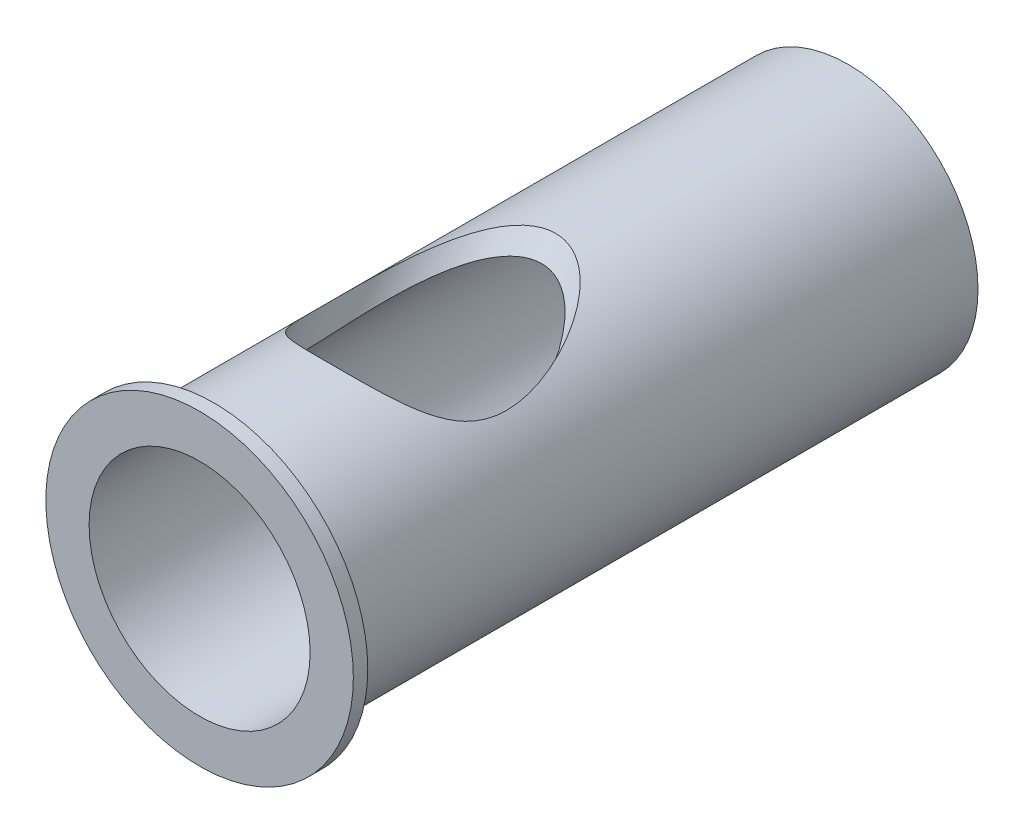
from build123d import *
from build123d.topology import SkipClean

# Parameters (mm, degrees)
ESQUISSE1_R                  = 8
ESQUISSE1_R_2                = 5.75
BASE_EXTRUSION_DEPTH         = 0.75
BOSS_EXTRU_1_START           = 33
ESQUISSE2_R                  = 6.75
ESQUISSE2_R_2                = 5.75
BOSS_EXTRU_1_DEPTH           = 33
ENL_V_MAT_EXTRU_1_REACH      = 34.989
ENL_V_MAT_EXTRU_1_END_RADIUS = 5.75
ESQUISSE3_R                  = 4.75


with BuildPart() as part:
    # Esquisse1 → Base-Extrusion (new body)
    with BuildSketch(Plane.XY):
        Circle(ESQUISSE1_R)
        Circle(ESQUISSE1_R_2, mode=Mode.SUBTRACT)
    extrude(amount=BASE_EXTRUSION_DEPTH)

    # Esquisse2 → Boss.-Extru.1 (add)
    with SkipClean():  # the faces are left unmerged after this step: merging them gives an invalid solid
        with BuildSketch(Plane(origin=(0, 0, 0), x_dir=(-1, 0, 0), z_dir=(0, 0, -1)).offset(BOSS_EXTRU_1_START)):
            with Locations(Location((0, 0, 0), (0, 0, 180))):
                Circle(ESQUISSE2_R)
            Circle(ESQUISSE2_R_2, mode=Mode.SUBTRACT)
        extrude(amount=-BOSS_EXTRU_1_DEPTH)

    # Enlèv. mat.-Extru.1: up to this cylinder (the profile starts outside it)
    with SkipClean():  # the faces are left unmerged after this step: merging them gives an invalid solid
        enl_v_mat_extru_1_end = Plane(origin=(0, 0, -15.816779), z_dir=(0, 0, -1)) * Cylinder(ENL_V_MAT_EXTRU_1_END_RADIUS, 82.478, mode=Mode.PRIVATE)
        # Esquisse3 → Enlèv. mat.-Extru.1 (cut, up to the surface)
        with BuildSketch(Plane(origin=(0, 15.463952723, -11.235219304), x_dir=(-1, 0, 0), z_dir=(0, 0.8090169943749307, -0.5877852522924963)), mode=Mode.PRIVATE) as enl_v_mat_extru_1_sk1:
            with Locations(Location((0, -5.663118961, 0), (0, 0, 90))):
                Circle(ESQUISSE3_R)
        enl_v_mat_extru_1_tool1 = extrude(enl_v_mat_extru_1_sk1.sketch, amount=-ENL_V_MAT_EXTRU_1_REACH, mode=Mode.PRIVATE) - enl_v_mat_extru_1_end
        add(enl_v_mat_extru_1_tool1.solids().sort_by_distance((0, 12.135255, -15.816779))[0], mode=Mode.SUBTRACT)


solid = part.part
